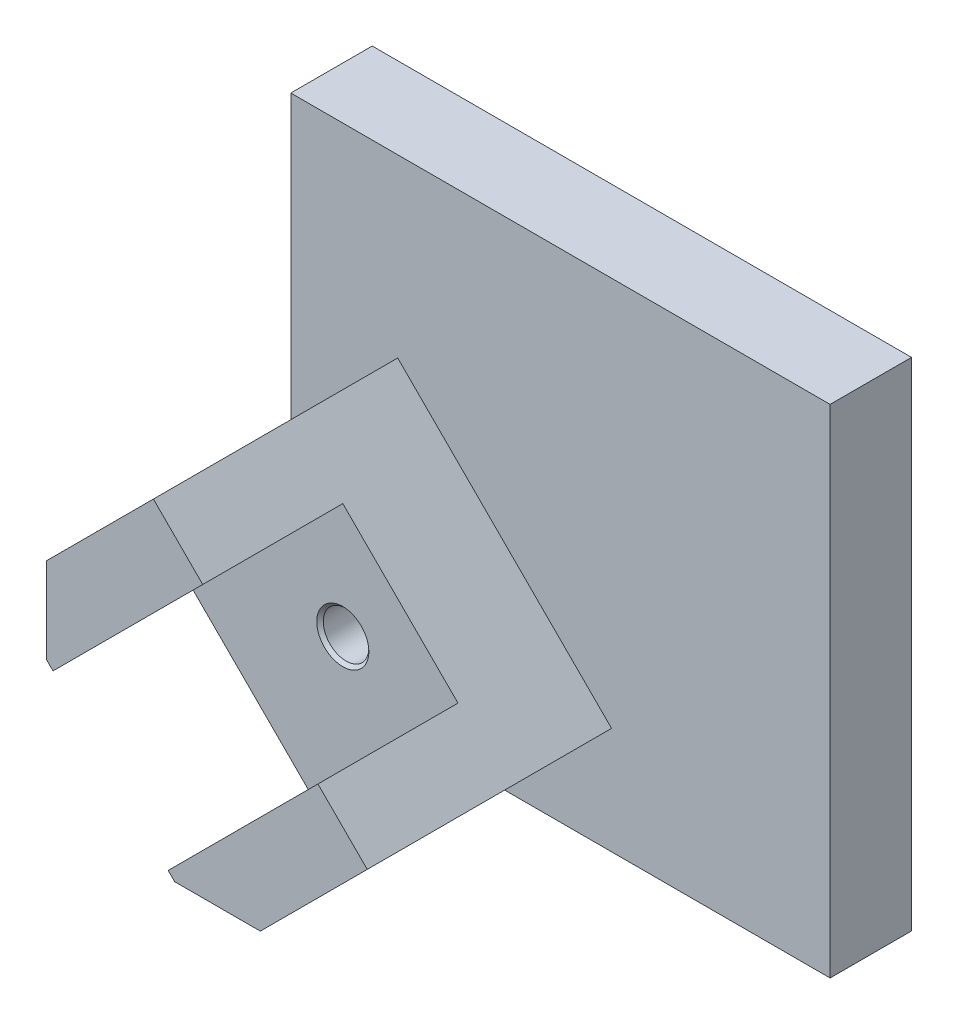
from build123d import *

# Parameters (mm, degrees)
BOSS_EXTRUDE1_DEPTH     = 27.432
BOSS_EXTRUDE2_DEPTH     = 5.08
SKETCH4_R               = 1.524
CUT_EXTRUDE1_DEPTH      = 2.286
SKETCH4_4_R             = 1.524
CUT_EXTRUDE2_DEPTH      = 63.630575033
BOSS_EXTRUDE3_DEPTH     = 3.81
FILLET1_R               = 2.54
CHAMFER3_SIZE           = 1.27
CHAMFER4_SIZE           = 0.254
SKETCH8_W               = 101.6
SKETCH8_H               = 44.45
CUT_EXTRUDE3_DEPTH      = 5.08
CHAMFER5_SIZE           = 1.27
BOSS_EXTRUDE4_DEPTH     = 6.35
FILLET2_R               = 1.27
BOSS_EXTRUDE5_DEPTH     = 19.05
CUT_EXTRUDE4_DEPTH      = 15.24
MIRROR3_COPY_1_DEPTH    = 15.24
CHAMFER7_SIZE           = 0.381
CUT_EXTRUDE6_DEPTH      = 2.54
MIRROR5_COPY_1_DEPTH    = 2.54
CUT_EXTRUDE7_DEPTH      = 10.922
SKETCH18_R              = 1.778
CUT_EXTRUDE8_DEPTH      = 8.382
MIRROR7_COPY_1_SKETCH_R = 1.778
MIRROR7_COPY_1_DEPTH    = 8.382
SKETCH19_W              = 135.869666512
SKETCH19_H              = 67.345799606
CUT_EXTRUDE9_DEPTH      = 31.242
BOSS_EXTRUDE6_DEPTH     = 20.32
SKETCH21_W              = 80.01
SKETCH21_H              = 52.07
BOSS_EXTRUDE7_DEPTH     = 3.81
FILLET3_R               = 2.54
CHAMFER8_SIZE           = 1.27
CHAMFER9_SIZE           = 0.254
CUT_EXTRUDE10_DEPTH     = 3.302
MIRROR9_COPY_1_DEPTH    = 3.302
CUT_EXTRUDE11_DEPTH     = 113.70847528


with BuildPart() as part:
    # Sketch1 → Boss-Extrude1 (new body)
    with BuildSketch(Plane(origin=(10.858740921, 0, 0), x_dir=(1, 0, 0), z_dir=(0, 0, 1))):
        Polygon((-52.705, 25.4), (-52.705, 21.59), (48.895, 21.59), (48.895, -22.86), (-52.705, -22.86), (-52.705, -25.4), (52.705, -25.4), (52.705, 25.4), align=None)
    extrude(amount=BOSS_EXTRUDE1_DEPTH)

    # Sketch1<3> → Boss-Extrude2 (add)
    with BuildSketch(Plane(origin=(10.858740921, 0, 0), x_dir=(1, 0, 0), z_dir=(0, 0, 1))):
        Polygon((48.895, 21.59), (-52.705, 21.59), (-52.705, 13.97), (-6.985, 13.97), (-6.985, -6.35), (-52.705, -6.35), (-52.705, -22.86), (48.895, -22.86), align=None)
    extrude(amount=BOSS_EXTRUDE2_DEPTH)

    # Sketch4 → Cut-Extrude1 (cut)
    # profile 1 of 4: a face of its own
    with BuildSketch(Plane(origin=(10.858740921, 0, 5.08), x_dir=(1, 0, 0), z_dir=(0, 0, 1))):
        Polygon((-44.785877438, 21.59), (-47.924122562, 21.59), (-49.493245123, 18.8722), (-47.924122562, 16.1544), (-44.785877438, 16.1544), (-43.216754877, 18.8722), align=None)
        with Locations((-46.355, 18.8722)):
            Circle(SKETCH4_R, mode=Mode.SUBTRACT)
    # profile 2 of 4: a face of its own
    with BuildSketch(Plane(origin=(10.858740921, 0, 5.08), x_dir=(1, 0, 0), z_dir=(0, 0, 1))):
        Polygon((21.126640721, 16.1544), (17.988395597, 16.1544), (16.419273036, 18.8722), (17.988395597, 21.59), (21.126640721, 21.59), (22.695763282, 18.8722), align=None)
        with Locations((19.557518159, 18.8722)):
            Circle(SKETCH4_R, mode=Mode.SUBTRACT)
    # profile 3 of 4: a face of its own
    with BuildSketch(Plane(origin=(10.858740921, 0, 5.08), x_dir=(1, 0, 0), z_dir=(0, 0, 1))):
        Polygon((22.695763282, -18.8722), (21.126640721, -16.1544), (17.988395597, -16.1544), (16.419273036, -18.8722), (17.988395597, -21.59), (21.126640721, -21.59), align=None)
        with Locations((19.557518159, -18.8722)):
            Circle(SKETCH4_R, mode=Mode.SUBTRACT)
    # profile 4 of 4: a face of its own
    with BuildSketch(Plane(origin=(10.858740921, 0, 5.08), x_dir=(1, 0, 0), z_dir=(0, 0, 1))):
        Polygon((-49.493245123, -18.8722), (-47.924122562, -16.1544), (-44.785877438, -16.1544), (-43.216754877, -18.8722), (-44.785877438, -21.59), (-47.924122562, -21.59), align=None)
        with Locations((-46.355, -18.8722)):
            Circle(SKETCH4_R, mode=Mode.SUBTRACT)
    extrude(amount=-CUT_EXTRUDE1_DEPTH, mode=Mode.SUBTRACT)

    # Sketch4<4> → Cut-Extrude2 (cut, through all)
    with BuildSketch(Plane(origin=(10.858740921, 0, 5.08), x_dir=(1, 0, 0), z_dir=(0, 0, 1))):
        with Locations((-46.355, 18.8722)):
            Circle(SKETCH4_4_R)
        with Locations((19.557518159, 18.8722)):
            Circle(SKETCH4_4_R)
        with Locations((-46.355, -18.8722)):
            Circle(SKETCH4_4_R)
        with Locations((19.557518159, -18.8722)):
            Circle(SKETCH4_4_R)
    extrude(amount=-CUT_EXTRUDE2_DEPTH, mode=Mode.SUBTRACT)

    # Sketch7 → Boss-Extrude3 (add)
    with BuildSketch(Plane(origin=(10.858740921, 0, 27.432), x_dir=(1, 0, 0), z_dir=(0, 0, 1))):
        Polygon((-52.705, 25.4), (52.705, 25.4), (52.705, -25.4), (-52.705, -25.4), (-52.705, -6.35), (-46.355, -6.35), (-46.355, 6.35), (-52.705, 6.35), align=None)
    extrude(amount=BOSS_EXTRUDE3_DEPTH)

    # Fillet1
    fillet1_edges = [part.edges().sort_by_distance(p)[0] for p in [
        (63.563740921, 25.4, 15.621),
        (63.563740921, -25.4, 15.621),
        (10.858740921, -25.4, 31.242),
        (63.563740921, 0, 31.242),
        (10.858740921, 25.4, 31.242),
    ]]
    fillet(fillet1_edges, radius=FILLET1_R)

    # Chamfer3
    chamfer3_edges = [part.edges().sort_by_distance(p)[0] for p in [
        (-41.846259079, 13.97, 27.432),
        (-41.846259079, 6.35, 29.337),
        (-41.846259079, 21.59, 16.256),
        (-41.846259079, -14.605, 27.432),
        (-41.846259079, -6.35, 29.337),
        (-38.671259079, 6.35, 31.242),
        (-35.496259079, 0, 31.242),
        (-38.671259079, -6.35, 31.242),
        (-41.846259079, -22.86, 16.256),
    ]]
    chamfer(chamfer3_edges, length=CHAMFER3_SIZE)

    # Chamfer4
    chamfer4_edges = [part.edges().sort_by_distance(p)[0] for p in [
        (28.892259079, 18.8722, 0),
        (-37.020259079, -18.8722, 0),
        (28.892259079, -18.8722, 0),
        (-37.020259079, 18.8722, 0),
    ]]
    chamfer(chamfer4_edges, length=CHAMFER4_SIZE)

    # Sketch8 → Cut-Extrude3 (cut)
    with BuildSketch(Plane(origin=(10.858740921, 0, 5.08), x_dir=(1, 0, 0), z_dir=(0, 0, 1))):
        with Locations((-1.905, -0.635)):
            Rectangle(SKETCH8_W, SKETCH8_H)
    extrude(amount=-CUT_EXTRUDE3_DEPTH, mode=Mode.SUBTRACT)

    # Chamfer5
    chamfer5_edges = [part.edges().sort_by_distance(p)[0] for p in [
        (-41.846259079, -22.86, 2.54),
        (-41.846259079, 21.59, 2.54),
    ]]
    chamfer(chamfer5_edges, length=CHAMFER5_SIZE)

    # Sketch9 → Boss-Extrude4 (add)
    with BuildSketch(Plane(origin=(10.858740921, 0, 0), x_dir=(-1, 0, 0), z_dir=(0, 0, -1))):
        Polygon((-90.741259079, 28.1), (-80.741259079, 38.1), (102.458740921, 38.1), (112.458740921, 28.1), (112.458740921, -28.1), (102.458740921, -38.1), (-80.741259079, -38.1), (-90.741259079, -28.1), align=None)
    extrude(amount=BOSS_EXTRUDE4_DEPTH)

    # Fillet2
    fillet2_edges = [part.edges().sort_by_distance(p)[0] for p in [
        (9.588740921, -25.4, 0),
        (63.563740921, 0, 0),
        (9.588740921, 25.4, 0),
        (62.819792145, 24.656051224, 0),
        (62.819792145, -24.656051224, 0),
    ]]
    fillet(fillet2_edges, radius=FILLET2_R)

    # Sketch11 → Boss-Extrude5 (add)
    with BuildSketch(Plane.XY):
        Polygon((-101.6, 28.1), (-91.6, 38.1), (-84.925667043, 38.1), (-76.588500564, 29.762833521), (-93.262833521, 13.088500564), (-101.6, 21.425667043), align=None)
        Polygon((84.925667043, 38.1), (76.588500564, 29.762833521), (93.262833521, 13.088500564), (101.6, 21.425667043), (101.6, 28.1), (91.6, 38.1), align=None)
        Polygon((91.6, -38.1), (84.925667043, -38.1), (76.588500564, -29.762833521), (93.262833521, -13.088500564), (101.6, -21.425667043), (101.6, -28.1), align=None)
        Polygon((-84.925667043, -38.1), (-76.588500564, -29.762833521), (-93.262833521, -13.088500564), (-101.6, -21.425667043), (-101.6, -28.1), (-91.6, -38.1), align=None)
    extrude(amount=BOSS_EXTRUDE5_DEPTH)

    # Sketch13 → Cut-Extrude4 (cut)
    with BuildSketch(Plane(origin=(-64.85, 64.85, 0), x_dir=(0, 0, 1), z_dir=(-0.7071067811865477, 0.7071067811865474, 0))):
        Polygon((-6.35, -44.901280605), (-6.35, -42.070807846), (-0.254, -38.551280605), (-0.254, -51.251280605), (-6.35, -47.731753364), align=None)
    cut_extrude4 = extrude(amount=-CUT_EXTRUDE4_DEPTH, mode=Mode.SUBTRACT)

    # Mirror2: Cut-Extrude4 across plane
    add(cut_extrude4.mirror(Plane.ZX), mode=Mode.SUBTRACT)

    # Mirror3: Cut-Extrude4 across plane
    add(cut_extrude4.mirror(Plane(origin=(0, 0, 0), x_dir=(0, 0, 1), z_dir=(1, 0, 0))), mode=Mode.SUBTRACT)

    # Mirror3 copy 1 sketch → Mirror3 copy 1 (cut)
    with BuildSketch(Plane(origin=(64.85, -64.85, 0), x_dir=(0, 0, 1), z_dir=(0.7071067811865477, -0.7071067811865474, 0))):
        Polygon((-6.35, -44.901280605), (-6.35, -42.070807846), (-0.254, -38.551280605), (-0.254, -51.251280605), (-6.35, -47.731753364), align=None)
    extrude(amount=-MIRROR3_COPY_1_DEPTH, mode=Mode.SUBTRACT)

    # Chamfer7
    chamfer7_edges = [part.edges().sort_by_distance(p)[0] for p in [
        (-99.845787271, 29.854212729, -3.302),
        (-96.6, 33.1, -0.254),
        (-93.354212729, 36.345787271, -3.302),
        (-99.845787271, -29.854212729, -3.302),
        (-96.6, -33.1, -0.254),
        (-93.354212729, -36.345787271, -3.302),
        (99.845787271, 29.854212729, -3.302),
        (96.6, 33.1, -0.254),
        (93.354212729, 36.345787271, -3.302),
        (99.845787271, -29.854212729, -3.302),
        (96.6, -33.1, -0.254),
        (93.354212729, -36.345787271, -3.302),
    ]]
    chamfer(chamfer7_edges, length=CHAMFER7_SIZE)

    # Sketch16 → Cut-Extrude6 (cut)
    with BuildSketch(Plane(origin=(0, 0, -6.35), x_dir=(-1, 0, 0), z_dir=(0, 0, -1))):
        Polygon((71.096072616, 17.294749227), (73.790149452, 19.988826063), (83.488826063, 10.290149452), (80.794749227, 7.596072616), align=None)
    cut_extrude6 = extrude(amount=-CUT_EXTRUDE6_DEPTH, mode=Mode.SUBTRACT)

    # Mirror4: Cut-Extrude6 across plane
    add(cut_extrude6.mirror(Plane.ZX), mode=Mode.SUBTRACT)

    # Mirror5: Cut-Extrude6 across plane
    add(cut_extrude6.mirror(Plane(origin=(0, 0, 0), x_dir=(0, 0, 1), z_dir=(1, 0, 0))), mode=Mode.SUBTRACT)

    # Mirror5 copy 1 sketch → Mirror5 copy 1 (cut)
    with BuildSketch(Plane(origin=(0, 0, -6.35), x_dir=(1, 0, 0), z_dir=(0, 0, -1))):
        Polygon((71.096072616, 17.294749227), (73.790149452, 19.988826063), (83.488826063, 10.290149452), (80.794749227, 7.596072616), align=None)
    extrude(amount=-MIRROR5_COPY_1_DEPTH, mode=Mode.SUBTRACT)

    # Sketch17 → Cut-Extrude7 (cut)
    with BuildSketch(Plane.XY.offset(19.05)):
        Polygon((-96.6, 33.1), (-92.109871939, 37.590128061), (-80.435538982, 25.915795103), (-89.415795103, 16.935538982), (-101.090128061, 28.609871939), align=None)
        Polygon((-80.435538982, -25.915795103), (-89.415795103, -16.935538982), (-101.090128061, -28.609871939), (-96.6, -33.1), (-92.109871939, -37.590128061), align=None)
        Polygon((92.109871939, -37.590128061), (80.435538982, -25.915795103), (89.415795103, -16.935538982), (101.090128061, -28.609871939), (96.6, -33.1), align=None)
        Polygon((80.435538982, 25.915795103), (89.415795103, 16.935538982), (101.090128061, 28.609871939), (96.6, 33.1), (92.109871939, 37.590128061), align=None)
    extrude(amount=-CUT_EXTRUDE7_DEPTH, mode=Mode.SUBTRACT)

    # Sketch18 → Cut-Extrude8 (cut)
    with BuildSketch(Plane.XY.offset(8.128)):
        with Locations((-89.415795103, 25.915795103)):
            Circle(SKETCH18_R)
    cut_extrude8 = extrude(amount=-CUT_EXTRUDE8_DEPTH, mode=Mode.SUBTRACT)

    # Mirror6: Cut-Extrude8 across plane
    add(cut_extrude8.mirror(Plane.ZX), mode=Mode.SUBTRACT)

    # Mirror7: Cut-Extrude8 across plane
    add(cut_extrude8.mirror(Plane(origin=(0, 0, 0), x_dir=(0, 0, 1), z_dir=(1, 0, 0))), mode=Mode.SUBTRACT)

    # Mirror7 copy 1 sketch → Mirror7 copy 1 (cut)
    with BuildSketch(Plane(origin=(0, 0, 8.128), x_dir=(-1, 0, 0), z_dir=(0, 0, 1))):
        with Locations((-89.415795103, 25.915795103)):
            Circle(MIRROR7_COPY_1_SKETCH_R)
    extrude(amount=-MIRROR7_COPY_1_DEPTH, mode=Mode.SUBTRACT)

    # Sketch19 → Cut-Extrude9 (cut)
    with BuildSketch(Plane.XY.offset(31.242)):
        Rectangle(SKETCH19_W, SKETCH19_H)
    extrude(amount=-CUT_EXTRUDE9_DEPTH, mode=Mode.SUBTRACT)

    # Sketch20 → Boss-Extrude6 (add)
    with BuildSketch(Plane.XY):
        Polygon((65.405, 22.86), (65.405, -21.59), (-10.795, -21.59), (-10.795, -25.4), (69.215, -25.4), (69.215, 26.67), (-10.795, 26.67), (-10.795, 22.86), align=None)
    extrude(amount=BOSS_EXTRUDE6_DEPTH)

    # Sketch21 → Boss-Extrude7 (add)
    with BuildSketch(Plane.XY.offset(20.32)):
        with Locations((29.21, 0.635)):
            Rectangle(SKETCH21_W, SKETCH21_H)
    extrude(amount=BOSS_EXTRUDE7_DEPTH)

    # Fillet3
    fillet3_edges = [part.edges().sort_by_distance(p)[0] for p in [
        (29.21, -25.4, 0),
        (69.215, 0.635, 0),
        (69.215, -25.4, 12.065),
        (29.21, 26.67, 0),
        (69.215, 26.67, 12.065),
        (29.21, -25.4, 24.13),
        (69.215, 0.635, 24.13),
        (29.21, 26.67, 24.13),
    ]]
    fillet(fillet3_edges, radius=FILLET3_R)

    # Chamfer8
    chamfer8_edges = [part.edges().sort_by_distance(p)[0] for p in [
        (-10.795, 22.86, 10.16),
        (-10.795, -21.59, 10.16),
        (-10.795, 0.635, 20.32),
    ]]
    chamfer(chamfer8_edges, length=CHAMFER8_SIZE)

    # Chamfer9
    chamfer9_edges = [part.edges().sort_by_distance(p)[0] for p in [
        (-91.193795103, 25.915795103, 8.128),
        (-91.193795103, -25.915795103, 8.128),
        (91.193795103, 25.915795103, 8.128),
        (91.193795103, -25.915795103, 8.128),
    ]]
    chamfer(chamfer9_edges, length=CHAMFER9_SIZE)

    # Sketch22 → Cut-Extrude10 (cut)
    with BuildSketch(Plane(origin=(0, 0, -0.254), x_dir=(-1, 0, 0), z_dir=(0, 0, -1))):
        Polygon((-85.016386052, -25.915795103), (-87.216090578, -22.105795103), (-91.615499629, -22.105795103), (-93.815204154, -25.915795103), (-91.615499629, -29.725795103), (-87.216090578, -29.725795103), align=None)
    cut_extrude10 = extrude(amount=-CUT_EXTRUDE10_DEPTH, mode=Mode.SUBTRACT)

    # Mirror8: Cut-Extrude10 across plane
    add(cut_extrude10.mirror(Plane.ZX), mode=Mode.SUBTRACT)

    # Mirror9: Cut-Extrude10 across plane
    add(cut_extrude10.mirror(Plane(origin=(0, 0, 0), x_dir=(0, 0, 1), z_dir=(1, 0, 0))), mode=Mode.SUBTRACT)

    # Mirror9 copy 1 sketch → Mirror9 copy 1 (cut)
    with BuildSketch(Plane(origin=(0, 0, -0.254), x_dir=(1, 0, 0), z_dir=(0, 0, -1))):
        Polygon((-85.016386052, -25.915795103), (-87.216090578, -22.105795103), (-91.615499629, -22.105795103), (-93.815204154, -25.915795103), (-91.615499629, -29.725795103), (-87.216090578, -29.725795103), align=None)
    extrude(amount=-MIRROR9_COPY_1_DEPTH, mode=Mode.SUBTRACT)

    # Sketch25 → Cut-Extrude11 (cut, through all)
    with BuildSketch(Plane.XY.offset(24.13)):
        Polygon((-59.549119492, -50.275205582), (111.201043926, -50.275205582), (111.201043926, 51.545205582), (-132.791043926, 51.545205582), (-132.791043926, 0.635), (-59.549119492, 0.635), align=None)
    extrude(amount=-CUT_EXTRUDE11_DEPTH, mode=Mode.SUBTRACT)


solid = part.part
